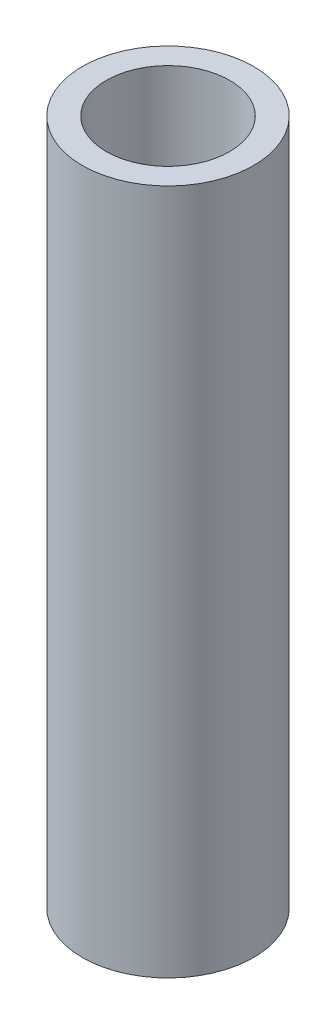
from build123d import *

# Parameters (mm, degrees)
SKETCH1_R           = 3.175
SKETCH1_R_2         = 2.286
BOSS_EXTRUDE1_DEPTH = 25.4


with BuildPart() as part:
    # Sketch1 → Boss-Extrude1 (new body)
    with BuildSketch(Plane(origin=(0, 0, 0), x_dir=(1, 0, 0), z_dir=(0, 1, 0))):
        with Locations(Location((0, 0, 0), (0, 0, 270))):
            Circle(SKETCH1_R)
        with Locations(Location((0, 0, 0), (0, 0, 270))):
            Circle(SKETCH1_R_2, mode=Mode.SUBTRACT)
    extrude(amount=BOSS_EXTRUDE1_DEPTH)


solid = part.part
